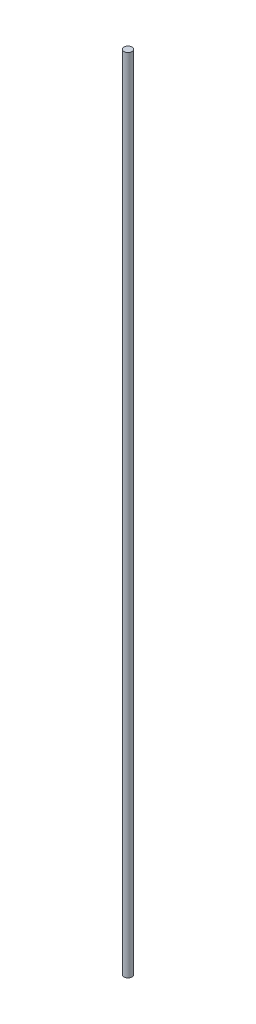
from build123d import *

# Parameters (mm, degrees)
SKETCH1_R           = 2
BOSS_EXTRUDE1_DEPTH = 400


with BuildPart() as part:
    # Sketch1 → Boss-Extrude1 (new body)
    with BuildSketch(Plane(origin=(0, 0, 0), x_dir=(1, 0, 0), z_dir=(0, 1, 0))):
        with Locations(Location((0, 0, 0), (0, 0, 270))):
            Circle(SKETCH1_R)
    extrude(amount=BOSS_EXTRUDE1_DEPTH)


solid = part.part
